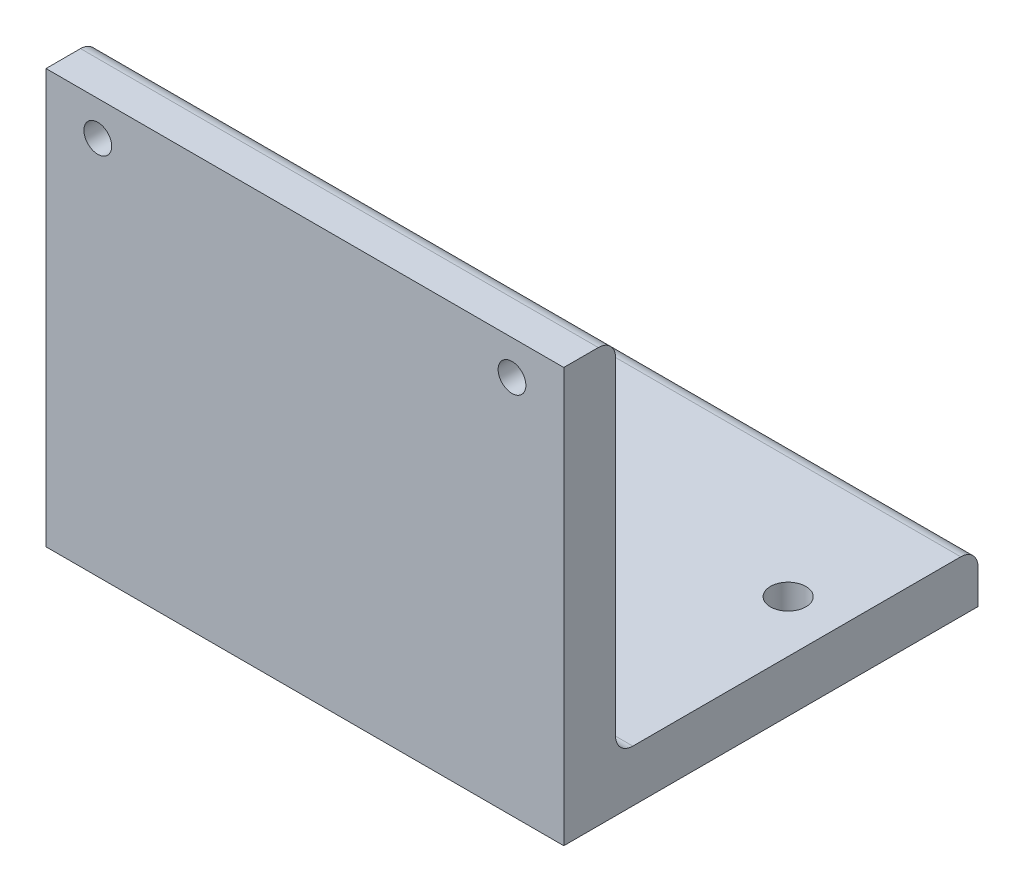
from build123d import *

# Parameters (mm, degrees)
BOSS_EXTRUDE1_DEPTH     = 47.625
FILLET1_R               = 3.175
F_1_4_20_TAPPED_HOLE1_D = 5.1054
F_1_4_CLEARANCE_HOLE1_D = 6.5278


with BuildPart() as part:
    # Sketch1 → Boss-Extrude1 (new, symmetric)
    with BuildSketch(Plane(origin=(0, 0, 0), x_dir=(0, 0, -1), z_dir=(1, 0, 0))):
        Polygon((0, 76.2), (0, 0), (76.2, 0), (76.2, 9.525), (9.525, 9.525), (9.525, 76.2), align=None)
    extrude(amount=BOSS_EXTRUDE1_DEPTH, both=True)

    # Fillet1
    fillet1_edges = [part.edges().sort_by_distance(p)[0] for p in [
        (0, 76.2, -9.525),
        (0, 9.525, -9.525),
        (0, 9.525, -76.2),
    ]]
    fillet(fillet1_edges, radius=FILLET1_R)

    # 1/4-20 Tapped Hole1 (through all)
    with Locations(Plane.XY):
        with Locations((-38.1, 69.85), (38.1, 69.85)):
            Hole(F_1_4_20_TAPPED_HOLE1_D / 2)

    # 1/4 Clearance Hole1 (through all)
    with Locations(Plane(origin=(0, 9.525, 0), x_dir=(1, 0, 0), z_dir=(0, 1, 0))):
        with Locations((-38.1, 50.8), (38.1, 50.8), (-12.7, 25.4), (12.7, 25.4)):
            Hole(F_1_4_CLEARANCE_HOLE1_D / 2)


solid = part.part
